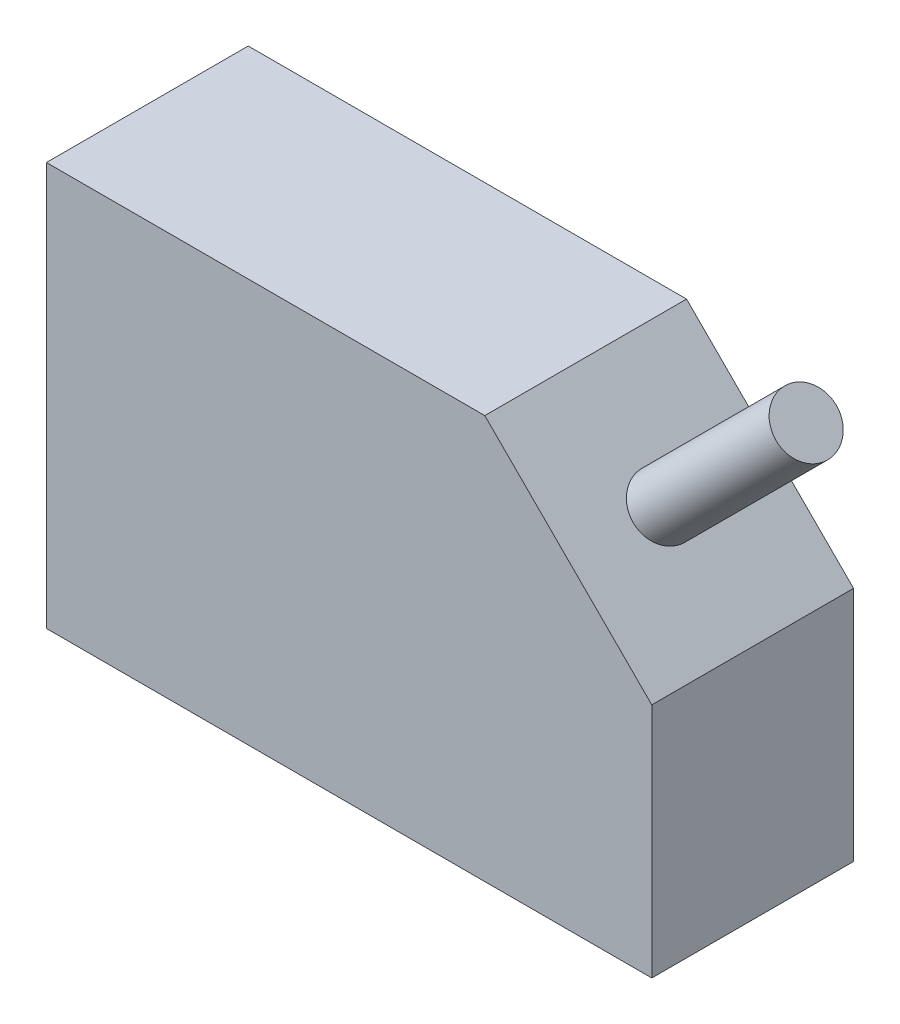
from build123d import *

# Parameters (mm, degrees)
BOSS_EXTRUDE1_DEPTH = 10


with BuildPart() as part:
    # Sketch1 → Boss-Extrude1 (new body)
    with BuildSketch(Plane(origin=(0, 0, 0), x_dir=(-1, 0, 0), z_dir=(0, 0, -1))):
        Polygon((-15, 1.724031376), (-15, -10), (15, -10), (15, 10), (-6.724031376, 10), align=None)
    extrude(amount=-BOSS_EXTRUDE1_DEPTH)

    # Sketch2 → Revolve1 (revolve)
    with BuildSketch(Plane.XY.offset(5.2823368)):
        Polygon((18.993743672, 11.872423328), (17.9330835, 12.9330835), (10.862015688, 5.862015688), (11.92267586, 4.801355516), align=None)
    revolve(axis=Axis((18.463413586, 13.463413586, 5.2823368), (-0.7071067811865389, -0.7071067811865562, 0)))


solid = part.part
